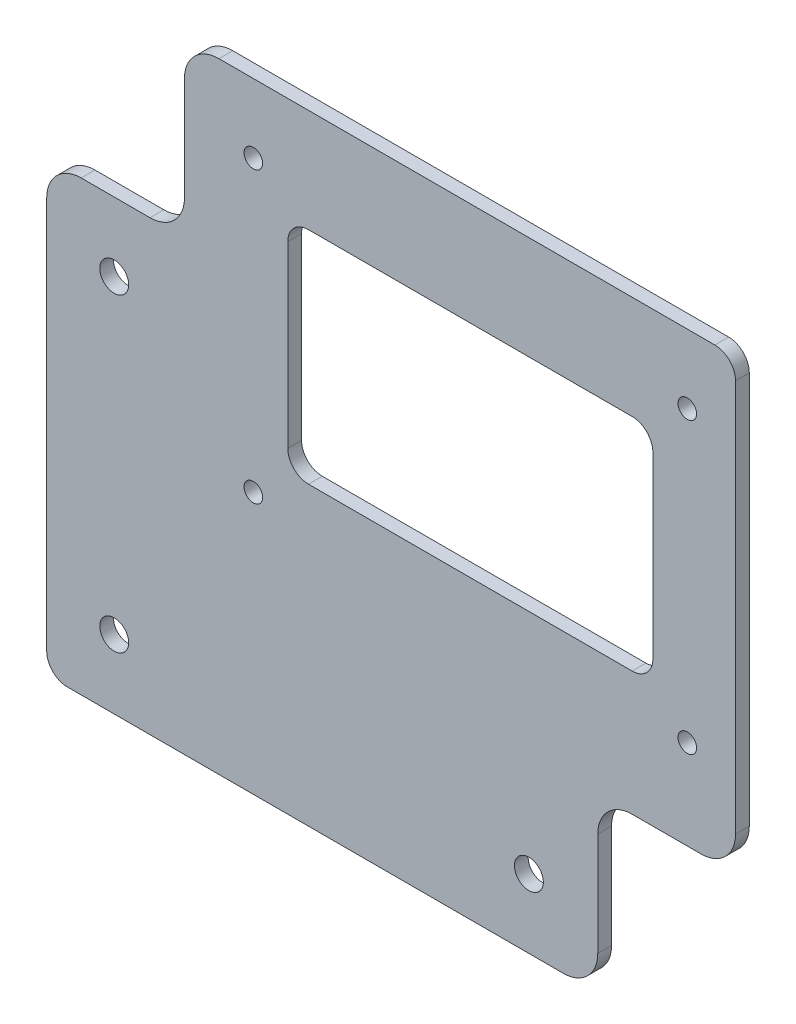
from build123d import *

# Parameters (mm, degrees)
SKETCH_1_W          = 100
SKETCH_1_H          = 90
EXTRUDE_1_DEPTH     = 2
SKETCH_2_R          = 2.1
CUT_EXTRUDE_1_DEPTH = 135.551105532
SKETCH_3_R          = 1.35
CUT_EXTRUDE_2_DEPTH = 135.551105532
FILLET_1_R          = 3
SKETCH_5_W          = 20
SKETCH_5_H          = 25
CUT_EXTRUDE_3_DEPTH = 10
FILLET_2_R          = 5


with BuildPart() as part:
    # 草图1 → 凸台-拉伸1 (new body)
    with BuildSketch(Plane.XY):
        with Locations((50, 45)):
            Rectangle(SKETCH_1_W, SKETCH_1_H)
    extrude(amount=EXTRUDE_1_DEPTH)

    # 草图2 → 切除-拉伸1 (cut, through all)
    with BuildSketch(Plane.XY.offset(2)):
        with Locations((9.8, 10)):
            Circle(SKETCH_2_R)
        with Locations((70, 10)):
            Circle(SKETCH_2_R)
        with Locations((9.8, 55)):
            Circle(SKETCH_2_R)
    extrude(amount=-CUT_EXTRUDE_1_DEPTH, mode=Mode.SUBTRACT)

    # 草图3 → 切除-拉伸2 (cut, through all)
    with BuildSketch(Plane.XY.offset(2)):
        with Locations((30, 80)):
            Circle(SKETCH_3_R)
        with Locations((93, 80)):
            Circle(SKETCH_3_R)
        with Locations((93, 38)):
            Circle(SKETCH_3_R)
        with Locations((30, 38)):
            Circle(SKETCH_3_R)
        with BuildLine():
            Line((38, 75), (85, 75))
            ThreePointArc((85, 75), (87.121320344, 74.121320344), (88, 72))
            Line((88, 72), (88, 46))
            ThreePointArc((88, 46), (87.121320344, 43.878679656), (85, 43))
            Line((85, 43), (38, 43))
            ThreePointArc((38, 43), (35.878679656, 43.878679656), (35, 46))
            Line((35, 46), (35, 72))
            ThreePointArc((35, 72), (35.878679656, 74.121320344), (38, 75))
        make_face()
    extrude(amount=-CUT_EXTRUDE_2_DEPTH, mode=Mode.SUBTRACT)

    # 圆角1
    fillet_1_edges = [part.edges().sort_by_distance(p)[0] for p in [
        (0, 90, 1),
        (100, 90, 1),
        (100, 0, 1),
        (0, 0, 1),
    ]]
    fillet(fillet_1_edges, radius=FILLET_1_R)

    # 草图5 → 切除-拉伸3 (cut)
    with BuildSketch(Plane.XY.offset(2)):
        with Locations((10, 77.5)):
            Rectangle(SKETCH_5_W, SKETCH_5_H)
        with Locations((90, 12.5)):
            Rectangle(SKETCH_5_W, SKETCH_5_H)
    extrude(amount=-CUT_EXTRUDE_3_DEPTH, mode=Mode.SUBTRACT)

    # 圆角2
    fillet_2_edges = [part.edges().sort_by_distance(p)[0] for p in [
        (0, 65, 1),
        (20, 90, 1),
        (20, 65, 1),
        (100, 25, 1),
        (80, 0, 1),
        (80, 25, 1),
    ]]
    fillet(fillet_2_edges, radius=FILLET_2_R)


solid = part.part
